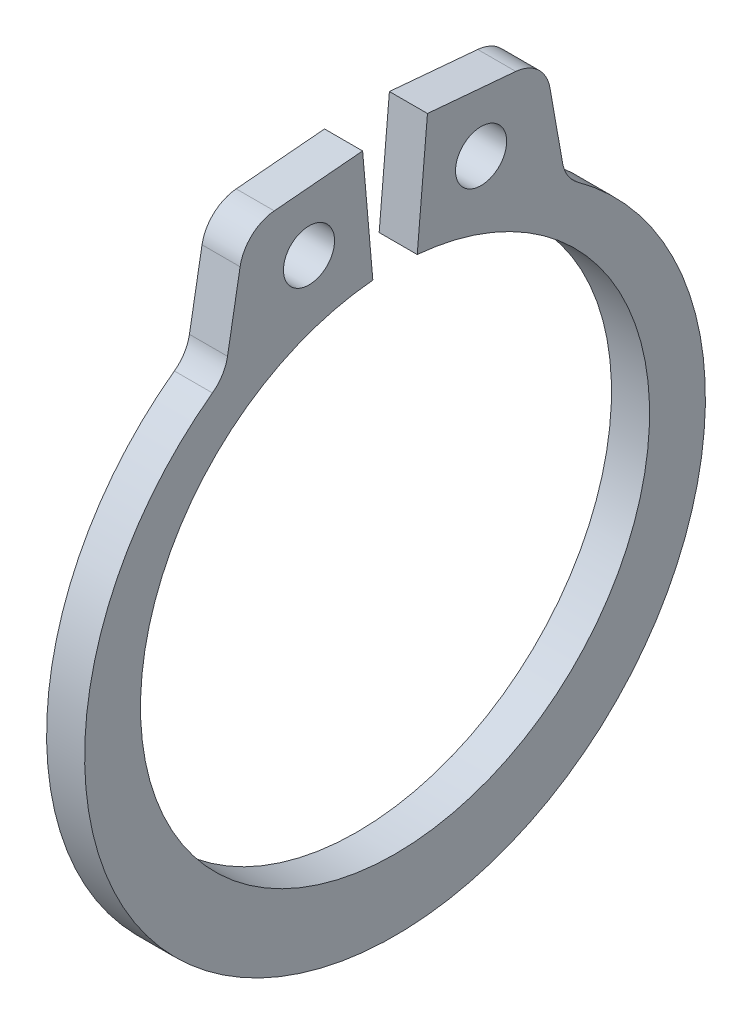
from build123d import *

# Parameters (mm, degrees)
SKETCH1_R      = 0.5969
EXTRUDE1_DEPTH = 0.4445
FILLET1_R      = 0.889


with BuildPart() as part:
    # Sketch1 → Extrude1 (new, symmetric)
    with BuildSketch(Plane(origin=(0, 0, 0), x_dir=(0, 0, -1), z_dir=(1, 0, 0))):
        with BuildLine():
            Line((-0.518018873, 5.920982808), (-0.757104506, 8.653744103))
            Line((-0.757104506, 8.653744103), (-3.499265184, 8.41383613))
            Line((-3.499265184, 8.41383613), (-3.975616865, 5.712311502))
            ThreePointArc((-3.975616865, 5.712311502), (0, -7.5946), (3.975616865, 5.712311502))
            Line((3.975616865, 5.712311502), (3.499265184, 8.41383613))
            Line((3.499265184, 8.41383613), (0.757104506, 8.653744103))
            Line((0.757104506, 8.653744103), (0.518018873, 5.920982808))
            ThreePointArc((0.518018873, 5.920982808), (0, -5.9436), (-0.518018873, 5.920982808))
        make_face()
        with Locations((-2.008642028, 7.167409469)):
            Circle(SKETCH1_R, mode=Mode.SUBTRACT)
        with Locations((2.008642028, 7.167409469)):
            Circle(SKETCH1_R, mode=Mode.SUBTRACT)
    extrude(amount=EXTRUDE1_DEPTH, both=True)

    # Fillet1
    fillet1_edges = [part.edges().sort_by_distance(p)[0] for p in [
        (0, 8.41383613, -3.499265184),
        (0, 5.712311502, -3.975616865),
        (0, 5.712311502, 3.975616865),
        (0, 8.41383613, 3.499265184),
    ]]
    fillet(fillet1_edges, radius=FILLET1_R)


solid = part.part
